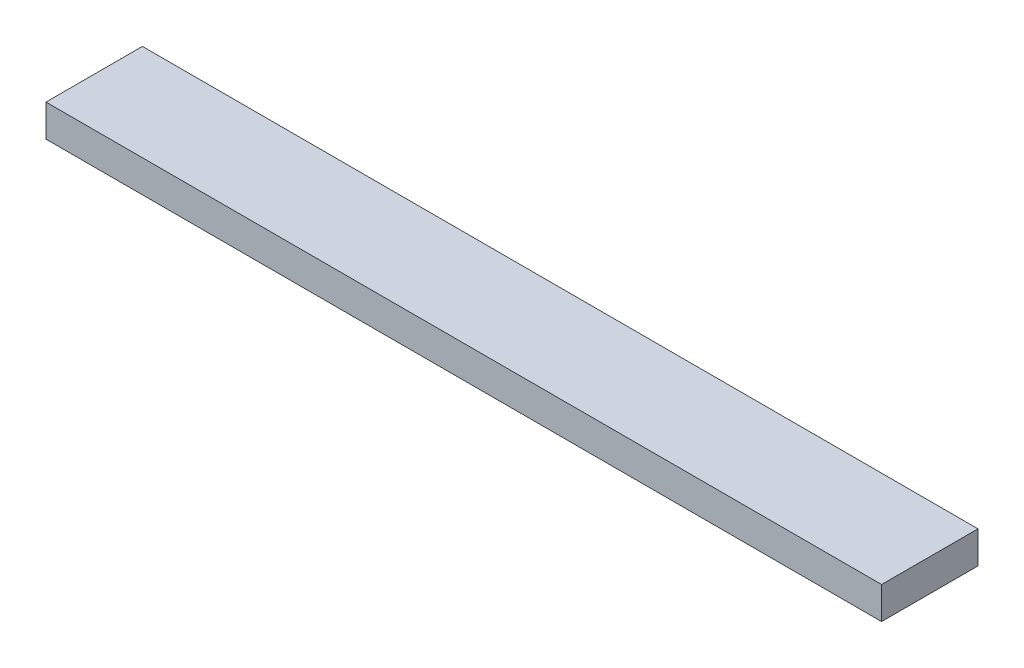
from build123d import *

# Parameters (mm, degrees)
CROSSSECTION_W             = 19.05
CROSSSECTION_H             = 6.35
F_1_4_INCH_THICKNESS_DEPTH = 82.55


with BuildPart() as part:
    # CrossSection → 1/4 Inch Thickness (new, symmetric)
    with BuildSketch(Plane(origin=(0, 0, 0), x_dir=(0, 0, -1), z_dir=(1, 0, 0))):
        Rectangle(CROSSSECTION_W, CROSSSECTION_H)
    extrude(amount=F_1_4_INCH_THICKNESS_DEPTH, both=True)


solid = part.part
